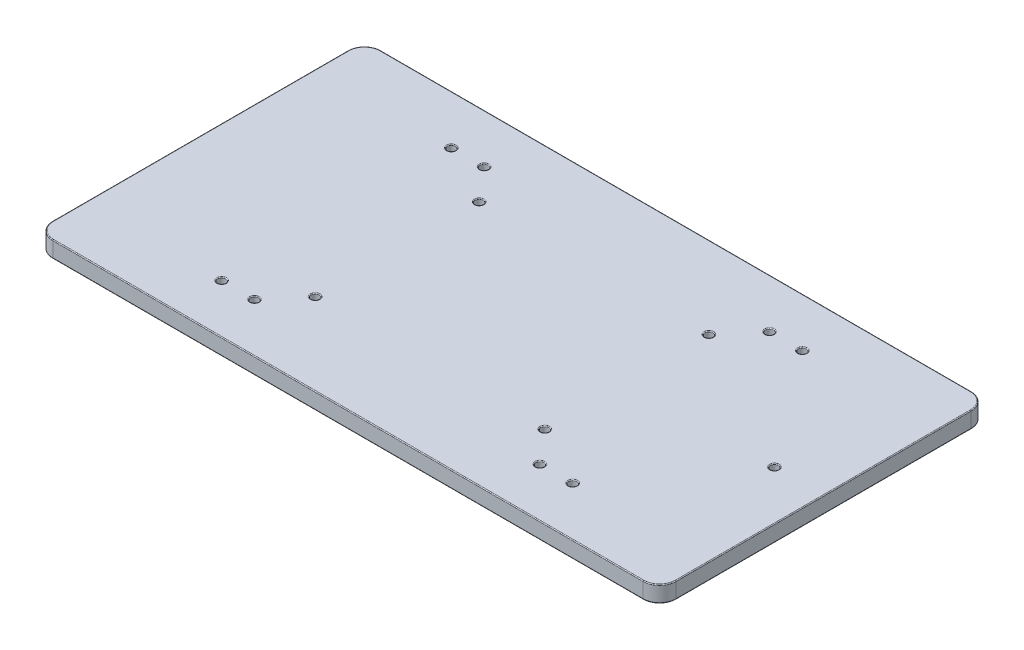
from build123d import *

# Parameters (mm, degrees)
SKETCH1_W           = 190
SKETCH1_H           = 100
SKETCH1_R           = 1.25
BOSS_EXTRUDE1_DEPTH = 5
FILLET1_R           = 5
FILLET2_R           = 0.25


with BuildPart() as part:
    # Sketch1 → Boss-Extrude1 (new body)
    with BuildSketch(Plane(origin=(0, 0, 0), x_dir=(1, 0, 0), z_dir=(0, 1, 0))):
        Rectangle(SKETCH1_W, SKETCH1_H)
        with Locations(Location((-35, 25, 0), (0, 0, 270))):
            Circle(SKETCH1_R, mode=Mode.SUBTRACT)
        with Locations(Location((35, 25, 0), (0, 0, 270))):
            Circle(SKETCH1_R, mode=Mode.SUBTRACT)
        with Locations(Location((35, -25, 0), (0, 0, 270))):
            Circle(SKETCH1_R, mode=Mode.SUBTRACT)
        with Locations(Location((-35, -25, 0), (0, 0, 270))):
            Circle(SKETCH1_R, mode=Mode.SUBTRACT)
        with Locations(Location((80, 0, 0), (0, 0, 270))):
            Circle(SKETCH1_R, mode=Mode.SUBTRACT)
        with Locations(Location((-53.5, -35, 0), (0, 0, 270))):
            Circle(SKETCH1_R, mode=Mode.SUBTRACT)
        with Locations(Location((-43.5, -35, 0), (0, 0, 270))):
            Circle(SKETCH1_R, mode=Mode.SUBTRACT)
        with Locations(Location((-43.5, 35, 0), (0, 0, 270))):
            Circle(SKETCH1_R, mode=Mode.SUBTRACT)
        with Locations(Location((-53.5, 35, 0), (0, 0, 270))):
            Circle(SKETCH1_R, mode=Mode.SUBTRACT)
        with Locations(Location((43.5, -35, 0), (0, 0, 270))):
            Circle(SKETCH1_R, mode=Mode.SUBTRACT)
        with Locations(Location((53.5, -35, 0), (0, 0, 270))):
            Circle(SKETCH1_R, mode=Mode.SUBTRACT)
        with Locations(Location((53.5, 35, 0), (0, 0, 270))):
            Circle(SKETCH1_R, mode=Mode.SUBTRACT)
        with Locations(Location((43.5, 35, 0), (0, 0, 270))):
            Circle(SKETCH1_R, mode=Mode.SUBTRACT)
    extrude(amount=BOSS_EXTRUDE1_DEPTH)

    # Fillet1
    fillet1_edges = [part.edges().sort_by_distance(p)[0] for p in [
        (95, 2.5, 50),
        (-95, 2.5, 50),
        (-95, 2.5, -50),
        (95, 2.5, -50),
    ]]
    fillet(fillet1_edges, radius=FILLET1_R)

    # Fillet2
    fillet2_edges = [part.edges().sort_by_distance(p)[0] for p in [
        (53.5, 5, 33.75),
        (-35, 5, 23.75),
        (53.5, 0, 33.75),
        (-53.5, 0, -36.25),
        (35, 5, -26.25),
        (-35, 0, -26.25),
        (80, 0, -1.25),
        (-53.5, 0, 33.75),
        (-43.5, 0, 33.75),
        (-43.5, 0, -36.25),
        (43.5, 0, 33.75),
        (53.5, 0, -36.25),
        (43.5, 0, -36.25),
        (35, 0, 23.75),
        (35, 0, -26.25),
        (-35, 0, 23.75),
        (35, 5, 23.75),
        (43.5, 5, -36.25),
        (53.5, 5, -36.25),
        (43.5, 5, 33.75),
        (-43.5, 5, -36.25),
        (0, 0, 50),
        (0, 5, 50),
        (-43.5, 5, 33.75),
        (95, 0, 0),
        (-95, 0, 0),
        (0, 0, -50),
        (93.535533906, 0, 48.535533906),
        (93.535533906, 0, -48.535533906),
        (-93.535533906, 0, -48.535533906),
        (-93.535533906, 0, 48.535533906),
        (-53.5, 5, 33.75),
        (-95, 5, 0),
        (95, 5, 0),
        (0, 5, -50),
        (93.535533906, 5, 48.535533906),
        (93.535533906, 5, -48.535533906),
        (-93.535533906, 5, -48.535533906),
        (80, 5, -1.25),
        (-93.535533906, 5, 48.535533906),
        (-35, 5, -26.25),
        (-53.5, 5, -36.25),
    ]]
    fillet(fillet2_edges, radius=FILLET2_R)


solid = part.part
